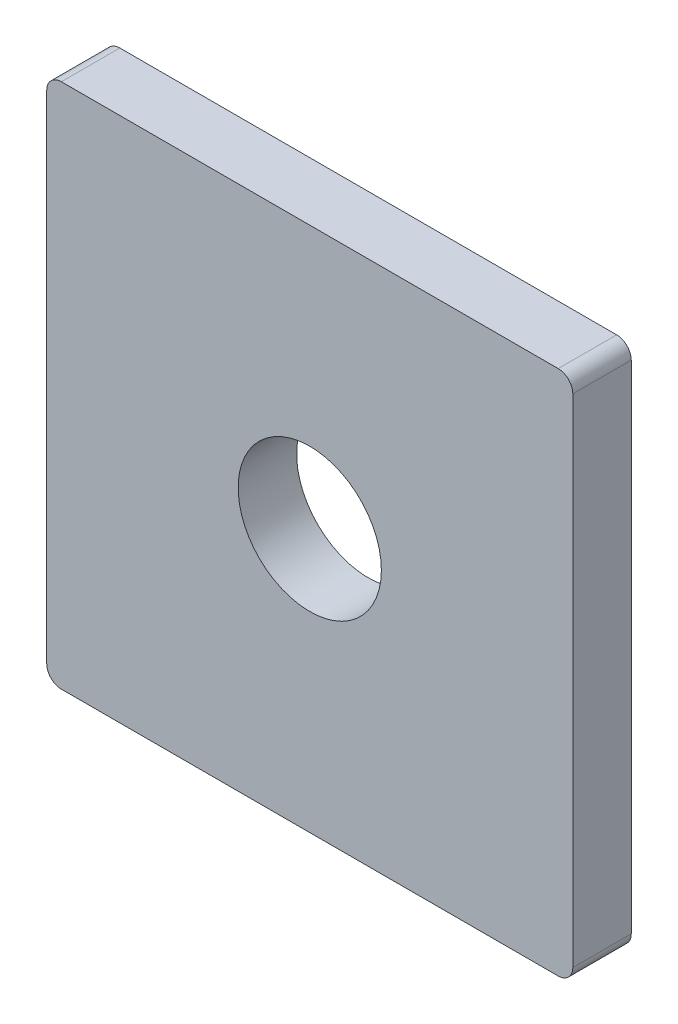
from build123d import *

# Parameters (mm, degrees)
SKETCH1_W           = 18
SKETCH1_H           = 18
SKETCH1_R           = 2.45
BOSS_EXTRUDE1_DEPTH = 2
FILLET1_R           = 0.5


with BuildPart() as part:
    # Sketch1 → Boss-Extrude1 (new body)
    with BuildSketch(Plane.XY):
        Rectangle(SKETCH1_W, SKETCH1_H)
        Circle(SKETCH1_R, mode=Mode.SUBTRACT)
    extrude(amount=BOSS_EXTRUDE1_DEPTH)

    # Fillet1
    fillet1_edges = [part.edges().sort_by_distance(p)[0] for p in [
        (9, -9, 1),
        (-9, -9, 1),
        (-9, 9, 1),
        (9, 9, 1),
    ]]
    fillet(fillet1_edges, radius=FILLET1_R)


solid = part.part
